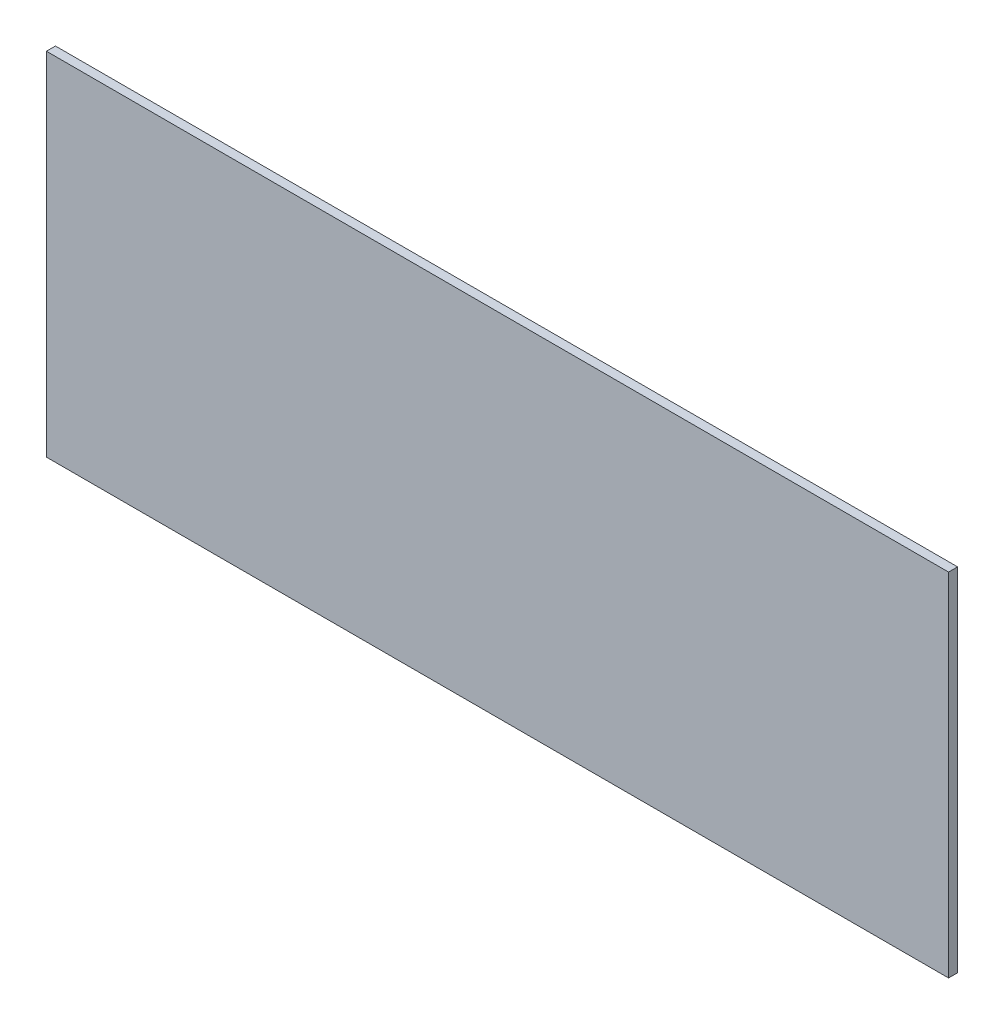
from build123d import *

# Parameters (mm, degrees)
SKETCH1_W           = 300
SKETCH1_H           = 116.9
BOSS_EXTRUDE1_DEPTH = 3


with BuildPart() as part:
    # Sketch1 → Boss-Extrude1 (new body)
    with BuildSketch(Plane.XY):
        with Locations((150, 58.45)):
            Rectangle(SKETCH1_W, SKETCH1_H)
    extrude(amount=BOSS_EXTRUDE1_DEPTH)


solid = part.part
